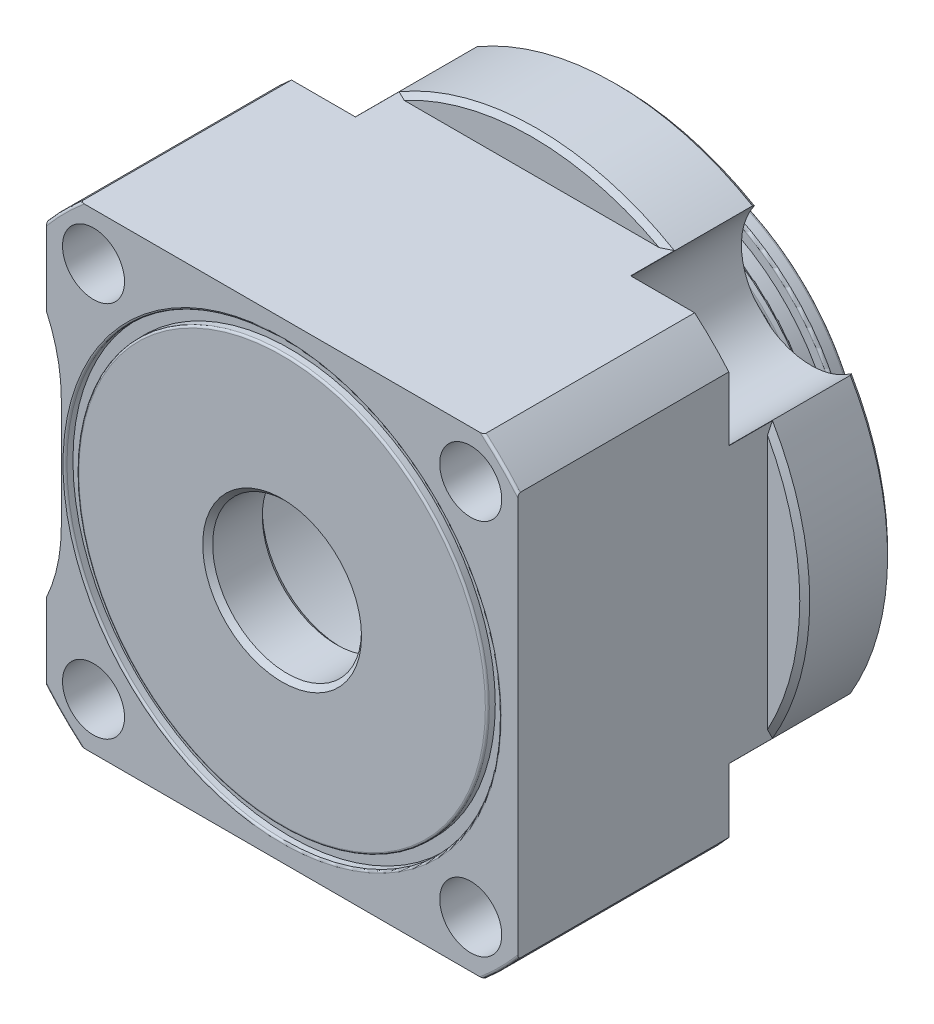
from build123d import *

# Parameters (mm, degrees)
SKETCH2_OUTSIDE_W            = 165.604
SKETCH2_OUTSIDE_H            = 165.604
CUT_EXTRUDE2_DEPTH           = 50.3
CUT_EXTRUDE4_DEPTH           = 110.80095628
SKETCH3_OUTSIDE_W            = 138.33
SKETCH3_OUTSIDE_H            = 145.83
CUT_EXTRUDE3_DEPTH           = 35
F_12_5_12_5_DIAMETER_HOLE1_D = 12.5
CUT_EXTRUDE5_DEPTH           = 42.5
CHAMFER1_SIZE                = 1


with BuildPart() as part:
    # Sketch1 → Revolve1 (revolve)
    with BuildSketch(Plane(origin=(0, 0, 0), x_dir=(0, 0, -1), z_dir=(1, 0, 0)), mode=Mode.PRIVATE) as revolve1_sk:
        with BuildLine():
            Line((1, 15), (0, 16))
            Line((0, 16), (0, 40.95))
            ThreePointArc((0, 40.95), (0.117157288, 41.232842712), (0.4, 41.35))
            Line((0.4, 41.35), (1.6, 41.35))
            Line((1.6, 41.35), (1.6, 43.75))
            Line((1.6, 43.75), (0.4, 43.75))
            ThreePointArc((0.4, 43.75), (0.117157288, 43.867157288), (0, 44.15))
            Line((0, 44.15), (0, 62))
            ThreePointArc((0, 62), (0.146446609, 62.353553391), (0.5, 62.5))
            Line((0.5, 62.5), (49.8, 62.5))
            ThreePointArc((49.8, 62.5), (50.153553391, 62.353553391), (50.3, 62))
            Line((50.3, 62), (50.3, 55))
            Line((50.3, 55), (67, 55))
            Line((67, 55), (68, 54))
            Line((68, 54), (68, 41))
            ThreePointArc((68, 41), (68.292893219, 40.292893219), (69, 40))
            Line((69, 40), (70, 40))
            ThreePointArc((70, 40), (70.353553391, 39.853553391), (70.5, 39.5))
            Line((70.5, 39.5), (70.5, 37.65))
            Line((70.5, 37.65), (74.5, 37.65))
            Line((74.5, 37.65), (74.5, 39.5))
            ThreePointArc((74.5, 39.5), (74.646446609, 39.853553391), (75, 40))
            Line((75, 40), (77, 40))
            ThreePointArc((77, 40), (77.353553391, 39.853553391), (77.5, 39.5))
            Line((77.5, 39.5), (77.5, 36.025))
            ThreePointArc((77.5, 36.025), (77.207106781, 35.317893219), (76.5, 35.025))
            Line((76.5, 35.025), (72.5, 35.025))
            Line((72.5, 35.025), (72.5, 33.525))
            ThreePointArc((72.5, 33.525), (72.207106781, 32.817893219), (71.5, 32.525))
            Line((71.5, 32.525), (12, 32.525))
            Line((12, 32.525), (12, 16))
            Line((12, 16), (11, 15))
            Line((11, 15), (1, 15))
        make_face()
    revolve(revolve1_sk.sketch.rotate(Axis((0, 0, 0), (0, 0, -1)), 90), axis=Axis((0, 0, 0), (0, 0, -1)))

    # Sketch2 outside → Cut-Extrude2 (cut)
    with BuildSketch(Plane.XY):
        Rectangle(SKETCH2_OUTSIDE_W, SKETCH2_OUTSIDE_H)
        with BuildLine():
            Line((-47.5, 47.5), (-47.5, 25))
            ThreePointArc((-47.5, 25), (-45.25872211, 18.287896555), (-44.5, 11.252272915))
            Line((-44.5, 11.252272915), (-44.5, -11.252272915))
            ThreePointArc((-44.5, -11.252272915), (-45.25872211, -18.287896555), (-47.5, -25))
            Line((-47.5, -25), (-47.5, -47.5))
            Line((-47.5, -47.5), (47.5, -47.5))
            Line((47.5, -47.5), (47.5, 47.5))
            Line((47.5, 47.5), (-47.5, 47.5))
        make_face(mode=Mode.SUBTRACT)
    extrude(amount=-CUT_EXTRUDE2_DEPTH, mode=Mode.SUBTRACT)

    # Sketch4 → Cut-Extrude4 (cut, through all)
    with BuildSketch(Plane.XY):
        with BuildLine():
            Line((-47.5, -25), (-47.5, -47.5))
            Line((-47.5, -47.5), (-61.505329276, -47.5))
            Line((-61.505329276, -47.5), (-61.505329276, 47.5))
            Line((-61.505329276, 47.5), (-47.5, 47.5))
            Line((-47.5, 47.5), (-47.5, 25))
            ThreePointArc((-47.5, 25), (-45.25872211, 18.287896555), (-44.5, 11.252272915))
            Line((-44.5, 11.252272915), (-44.5, -11.252272915))
            ThreePointArc((-44.5, -11.252272915), (-45.25872211, -18.287896555), (-47.5, -25))
        make_face()
    extrude(amount=-CUT_EXTRUDE4_DEPTH, mode=Mode.SUBTRACT)

    # Sketch3 outside → Cut-Extrude3 (cut)
    with BuildSketch(Plane(origin=(0, 0, -77.5), x_dir=(-1, 0, 0), z_dir=(0, 0, -1))):
        with Locations((-3.75, 0)):
            Rectangle(SKETCH3_OUTSIDE_W, SKETCH3_OUTSIDE_H)
        with BuildLine():
            Line((28.298367752, 28.989342534), (44.501972767, 11.613103526))
            ThreePointArc((44.501972767, 11.613103526), (44.500493195, 11.432690917), (44.5, 11.252272915))
            Line((44.5, 11.252272915), (44.5, -11.252272915))
            ThreePointArc((44.5, -11.252272915), (44.500493195, -11.432690917), (44.501972767, -11.613103526))
            Line((44.501972767, -11.613103526), (28.298367752, -28.989342534))
            ThreePointArc((28.298367752, -28.989342534), (24.543163283, -38.132857362), (27.7640046, -47.477995414))
            ThreePointArc((27.7640046, -47.477995414), (0, -55), (-27.7640046, -47.477995414))
            ThreePointArc((-27.7640046, -47.477995414), (-28.637824638, -28.637824638), (-47.477995414, -27.7640046))
            ThreePointArc((-47.477995414, -27.7640046), (-55, 0), (-47.477995414, 27.7640046))
            ThreePointArc((-47.477995414, 27.7640046), (-28.637824638, 28.637824638), (-27.7640046, 47.477995414))
            ThreePointArc((-27.7640046, 47.477995414), (0, 55), (27.7640046, 47.477995414))
            ThreePointArc((27.7640046, 47.477995414), (24.543163283, 38.132857362), (28.298367752, 28.989342534))
        make_face(mode=Mode.SUBTRACT)
    extrude(amount=-CUT_EXTRUDE3_DEPTH, mode=Mode.SUBTRACT)

    # Ø12.5 (12.5) Diameter Hole1 (through all)
    with Locations(Plane.XY):
        with Locations((-38, 38), (38, 38), (38, -38), (-38, -38)):
            Hole(F_12_5_12_5_DIAMETER_HOLE1_D / 2)

    # Sketch8 → Cut-Extrude5 (cut)
    with BuildSketch(Plane(origin=(0, 0, 0), x_dir=(1, 0, 0), z_dir=(0, 1, 0))):
        with BuildLine():
            Line((-5.5, 77.5), (5.5, 77.5))
            ThreePointArc((5.5, 77.5), (4.403623683, 76.050510257), (2.671572875, 75.5))
            Line((2.671572875, 75.5), (-2.671572875, 75.5))
            ThreePointArc((-2.671572875, 75.5), (-4.403623683, 76.050510257), (-5.5, 77.5))
        make_face()
    extrude(amount=-CUT_EXTRUDE5_DEPTH, mode=Mode.SUBTRACT)

    # Chamfer1
    chamfer1_edges = [part.edges().sort_by_distance(p)[0] for p in [
        (0, 55, -50.3),
        (0, -55, -50.3),
        (55, 0, -50.3),
    ]]
    chamfer(chamfer1_edges, length=CHAMFER1_SIZE)


solid = part.part
